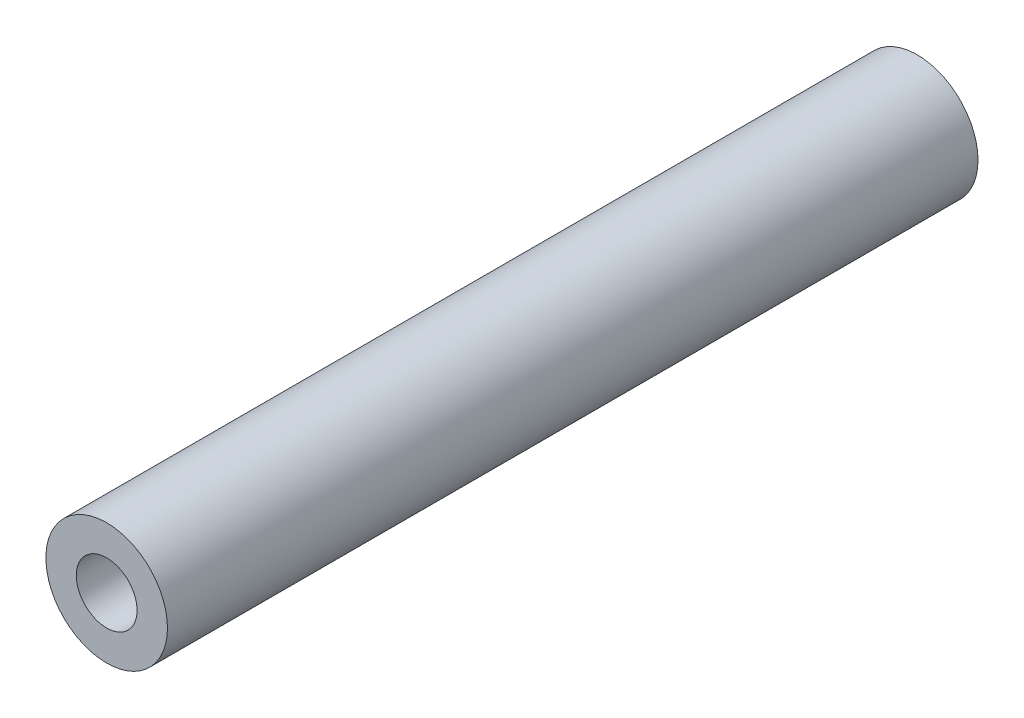
from build123d import *

# Parameters (mm, degrees)
SKETCH_1_R      = 3
SKETCH_1_R_2    = 1.5
EXTRUDE_1_DEPTH = 40


with BuildPart() as part:
    # 草图1 → 凸台-拉伸1 (new body)
    with BuildSketch(Plane.XY):
        Circle(SKETCH_1_R)
        Circle(SKETCH_1_R_2, mode=Mode.SUBTRACT)
    extrude(amount=EXTRUDE_1_DEPTH)


solid = part.part
